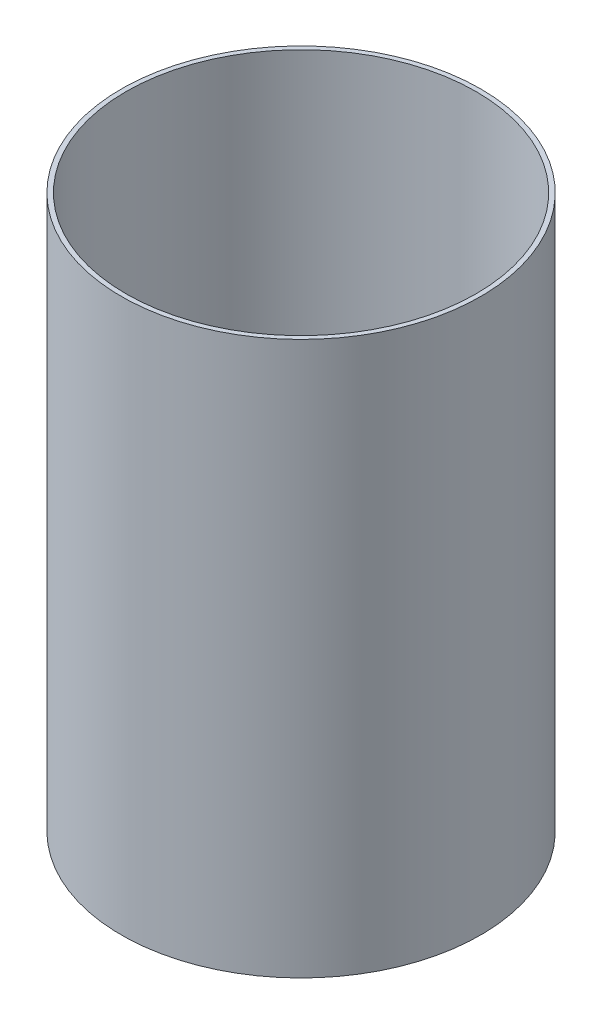
from build123d import *

# Parameters (mm, degrees)
SKETCH1_R           = 49.53
SKETCH1_R_2         = 48.26
BOSS_EXTRUDE1_DEPTH = 152.4


with BuildPart() as part:
    # Sketch1 → Boss-Extrude1 (new body)
    with BuildSketch(Plane(origin=(0, 0, 0), x_dir=(1, 0, 0), z_dir=(0, 1, 0))):
        with Locations(Location((0, 0, 0), (0, 0, 90))):
            Circle(SKETCH1_R)
        with Locations(Location((0, 0, 0), (0, 0, 90))):
            Circle(SKETCH1_R_2, mode=Mode.SUBTRACT)
    extrude(amount=BOSS_EXTRUDE1_DEPTH)


solid = part.part
